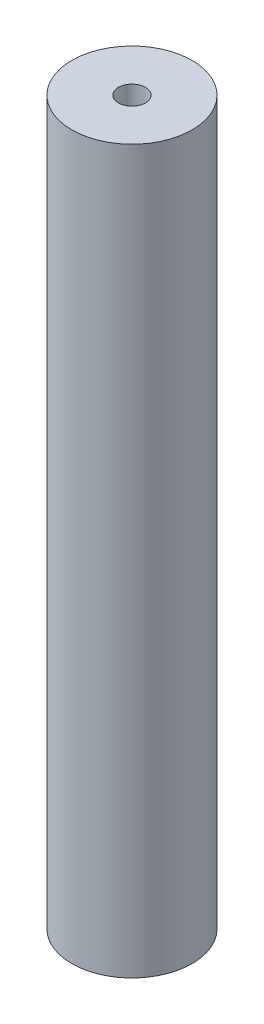
from build123d import *

# Parameters (mm, degrees)
SKETCH1_R           = 10
BOSS_EXTRUDE1_DEPTH = 120
SKETCH2_R           = 2.25
CUT_EXTRUDE1_DEPTH  = 120


with BuildPart() as part:
    # Sketch1 → Boss-Extrude1 (new body)
    with BuildSketch(Plane(origin=(0, 0, 0), x_dir=(1, 0, 0), z_dir=(0, 1, 0))):
        with Locations(Location((0, 0, 0), (0, 0, 270))):
            Circle(SKETCH1_R)
    extrude(amount=BOSS_EXTRUDE1_DEPTH)

    # Sketch2 → Cut-Extrude1 (cut)
    with BuildSketch(Plane(origin=(0, 120, 0), x_dir=(1, 0, 0), z_dir=(0, 1, 0))):
        with Locations(Location((0, 0, 0), (0, 0, 270))):
            Circle(SKETCH2_R)
    extrude(amount=-CUT_EXTRUDE1_DEPTH, mode=Mode.SUBTRACT)


solid = part.part
